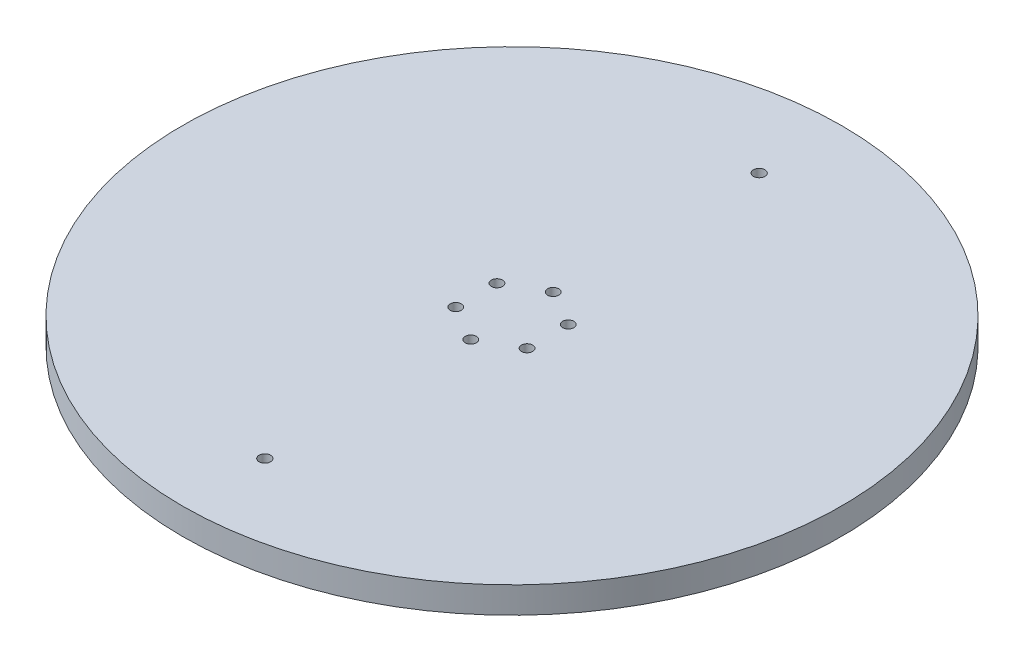
from build123d import *

# Parameters (mm, degrees)
SKETCH1_R             = 200
BOSS_EXTRUDE1_DEPTH   = 16
M8_TAPPED_HOLE1_D     = 6.8
CIRPATTERN1_COUNT     = 6
M8X1_0_TAPPED_HOLE1_D = 7


with BuildPart() as part:
    # Sketch1 → Boss-Extrude1 (new body)
    with BuildSketch(Plane(origin=(0, 0, 0), x_dir=(1, 0, 0), z_dir=(0, 1, 0))):
        Circle(SKETCH1_R)
    extrude(amount=BOSS_EXTRUDE1_DEPTH)

    # M8 Tapped Hole1 (through all)
    with Locations(Plane(origin=(0, 16, 0), x_dir=(1, 0, 0), z_dir=(0, 1, 0))):
        with Locations((0, 25)):
            m8_tapped_hole1 = Hole(M8_TAPPED_HOLE1_D / 2)

    # CirPattern1: M8 Tapped Hole1 ×6 about axis
    cirpattern1_axis = Axis((0, -43.514912226, 0), (0, 1, 0))
    for i in range(1, CIRPATTERN1_COUNT):
        add(m8_tapped_hole1.rotate(cirpattern1_axis, i * 360 / CIRPATTERN1_COUNT), mode=Mode.SUBTRACT)

    # M8x1.0 Tapped Hole1 (through all)
    with Locations(Plane(origin=(0, 16, 0), x_dir=(1, 0, 0), z_dir=(0, 1, 0))):
        with Locations((0, 150), (0, -150)):
            Hole(M8X1_0_TAPPED_HOLE1_D / 2)


solid = part.part
